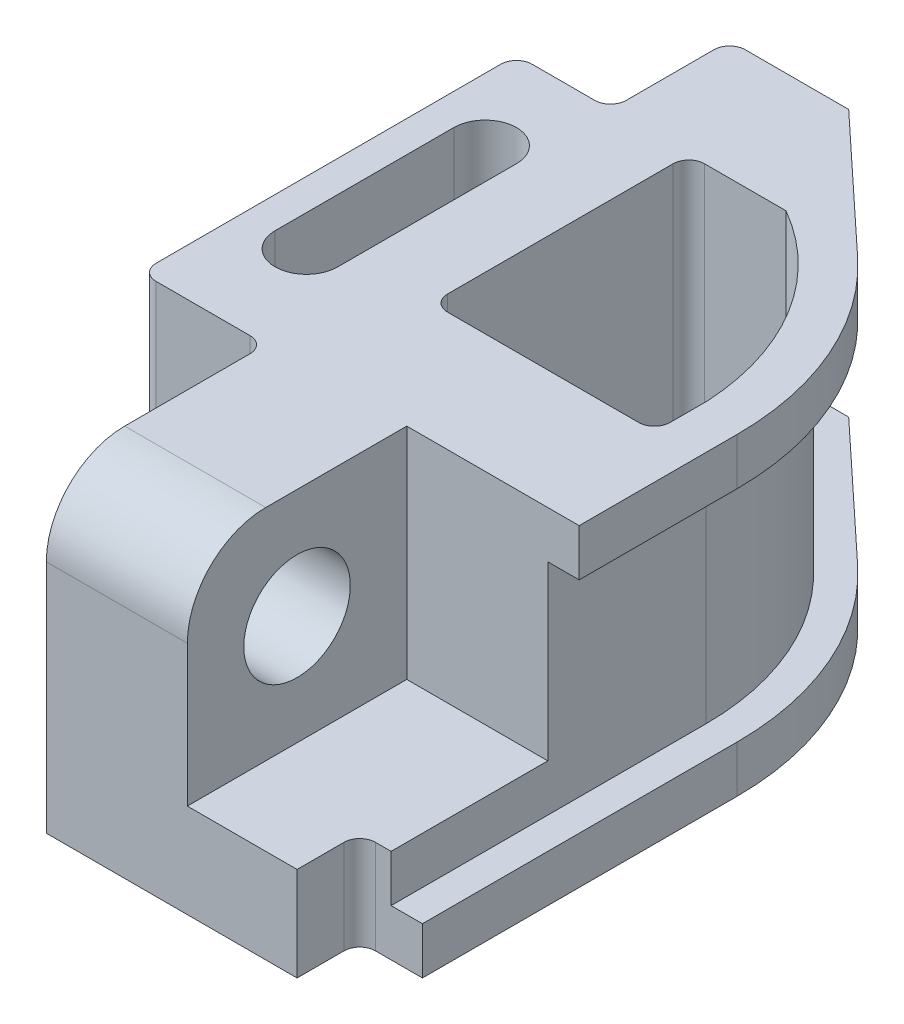
from build123d import *

# Parameters (mm, degrees)
BOSS_EXTRUDE1_DEPTH = 100
CUT_EXTRUDE1_DEPTH  = 70
SKETCH3_W           = 55
SKETCH3_H           = 70
CUT_EXTRUDE2_DEPTH  = 70
FILLET1_R           = 25
CUT_EXTRUDE3_REACH  = 214.047
SKETCH4_R           = 17
CUT_EXTRUDE4_DEPTH  = 25
CUT_EXTRUDE5_START  = -25
CUT_EXTRUDE5_DEPTH  = 25
CUT_EXTRUDE6_DEPTH  = 85


with BuildPart() as part:
    # Sketch1 → Boss-Extrude1 (new body)
    with BuildSketch(Plane(origin=(0, 0, 0), x_dir=(1, 0, 0), z_dir=(0, 1, 0))):
        with BuildLine():
            Line((0, 5), (0, 115))
            ThreePointArc((0, 115), (1.464466094, 118.535533906), (5, 120))
            Line((5, 120), (25, 120))
            ThreePointArc((25, 120), (28.535533906, 121.464466094), (30, 125))
            Line((30, 125), (30, 153))
            ThreePointArc((30, 153), (31.464466094, 156.535533906), (35, 158))
            Line((35, 158), (68, 158))
            Line((68, 158), (110.425847486, 118.437257177))
            ThreePointArc((110.425847486, 118.437257177), (132.286586918, 87.505026337), (140, 50.421362927))
            Line((140, 50.421362927), (140, -50))
            Line((140, -50), (125, -50))
            ThreePointArc((125, -50), (121.464466094, -51.464466094), (120, -55))
            Line((120, -55), (120, -70))
            Line((120, -70), (40, -70))
            Line((40, -70), (40, -5))
            ThreePointArc((40, -5), (38.535533906, -1.464466094), (35, 0))
            Line((35, 0), (5, 0))
            ThreePointArc((5, 0), (1.464466094, 1.464466094), (0, 5))
        make_face()
    extrude(amount=BOSS_EXTRUDE1_DEPTH)

    # Sketch2 → Cut-Extrude1 (cut)
    with BuildSketch(Plane(origin=(0, 15, 0), x_dir=(-1, 0, 0), z_dir=(0, -1, 0))):
        with BuildLine():
            Line((-53.337208144, 158), (-103.605863885, 111.123720161))
            ThreePointArc((-103.605863885, 111.123720161), (-123.115986174, 83.517535648), (-130, 50.421362927))
            Line((-130, 50.421362927), (-130, -50))
            Line((-130, -50), (-140, -50))
            Line((-140, -50), (-140, 50.421362927))
            ThreePointArc((-140, 50.421362927), (-132.286586918, 87.505026337), (-110.425847486, 118.437257177))
            Line((-110.425847486, 118.437257177), (-68, 158))
            Line((-68, 158), (-53.337208144, 158))
        make_face()
    extrude(amount=-CUT_EXTRUDE1_DEPTH, mode=Mode.SUBTRACT)

    # Sketch3 → Cut-Extrude2 (cut)
    with BuildSketch(Plane(origin=(0, 100, 0), x_dir=(1, 0, 0), z_dir=(0, 1, 0))):
        with Locations((112.5, -35)):
            Rectangle(SKETCH3_W, SKETCH3_H)
    extrude(amount=-CUT_EXTRUDE2_DEPTH, mode=Mode.SUBTRACT)

    # Fillet1
    fillet1_edges = [part.edges().sort_by_distance(p)[0] for p in [
        (62.5, 100, 70),
    ]]
    fillet(fillet1_edges, radius=FILLET1_R)

    # Sketch4 → Cut-Extrude3 (cut, up to next)
    with BuildSketch(Plane.ZY.offset(-40), mode=Mode.PRIVATE) as cut_extrude3_sk1:
        with Locations((35, 65)):
            Circle(SKETCH4_R)
    cut_extrude3_tool1 = extrude(cut_extrude3_sk1.sketch, amount=-CUT_EXTRUDE3_REACH, mode=Mode.PRIVATE) & part.part
    add(cut_extrude3_tool1.solids().sort_by_distance((40, 65, 35))[0], mode=Mode.SUBTRACT)

    # Sketch5 → Cut-Extrude4 (cut)
    with BuildSketch(Plane(origin=(0, 100, 0), x_dir=(1, 0, 0), z_dir=(0, 1, 0))):
        with BuildLine():
            Line((30, 90), (30, 33))
            ThreePointArc((30, 33), (20, 23), (10, 33))
            Line((10, 33), (10, 90))
            ThreePointArc((10, 90), (20, 100), (30, 90))
        make_face()
    extrude(amount=-CUT_EXTRUDE4_DEPTH, mode=Mode.SUBTRACT)

    # Sketch6 → Cut-Extrude5 (cut)
    with BuildSketch(Plane.XZ.offset(CUT_EXTRUDE5_START)):
        with BuildLine():
            Line((30, -33), (30, -90))
            ThreePointArc((30, -90), (20, -100), (10, -90))
            Line((10, -90), (10, -33))
            ThreePointArc((10, -33), (20, -23), (30, -33))
        make_face()
    extrude(amount=CUT_EXTRUDE5_DEPTH, mode=Mode.SUBTRACT)

    # Sketch7 → Cut-Extrude6 (cut)
    with BuildSketch(Plane(origin=(0, 100, 0), x_dir=(1, 0, 0), z_dir=(0, 1, 0))):
        with BuildLine():
            Line((55, 115), (55, 43))
            ThreePointArc((55, 43), (56.464466094, 39.464466094), (60, 38))
            Line((60, 38), (121, 38))
            ThreePointArc((121, 38), (124.535533906, 39.464466094), (126, 43))
            Line((126, 43), (126, 55))
            ThreePointArc((126, 55), (114.251031375, 92.577557769), (86, 120))
            Line((86, 120), (60, 120))
            ThreePointArc((60, 120), (56.464466094, 118.535533906), (55, 115))
        make_face()
    extrude(amount=-CUT_EXTRUDE6_DEPTH, mode=Mode.SUBTRACT)


solid = part.part
